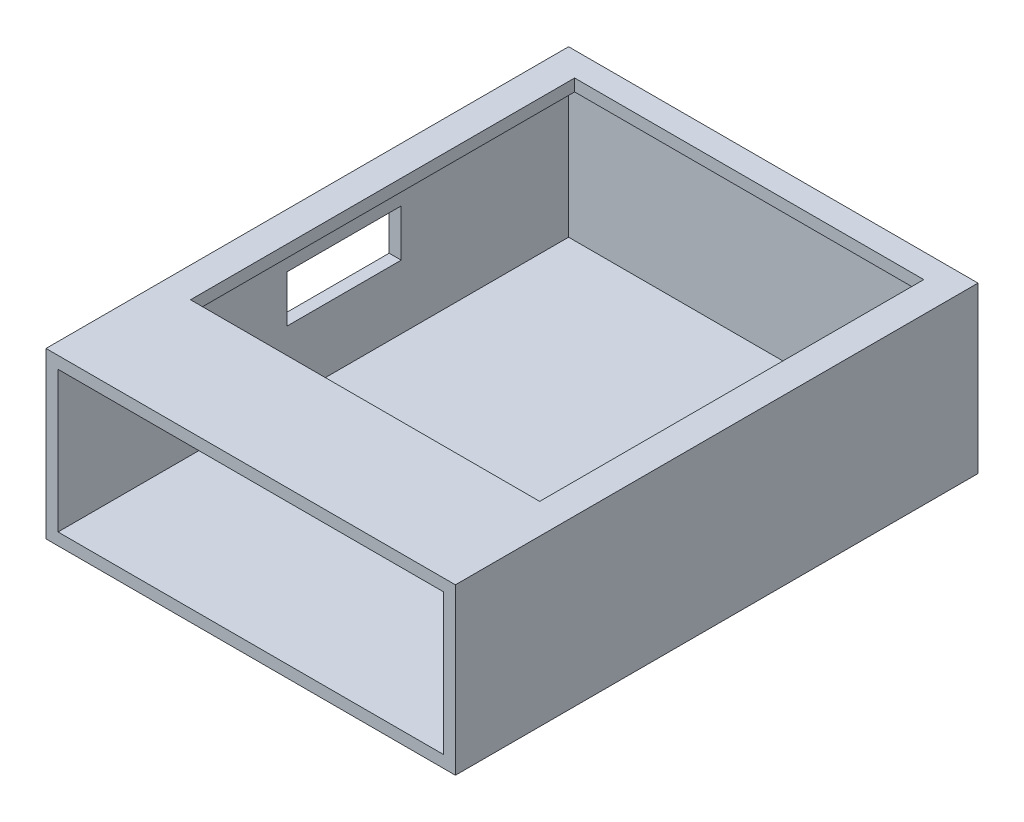
from build123d import *

# Parameters (mm, degrees)
SKETCH_1_W            = 32
SKETCH_1_H            = 42.4
EXTRUDE_1_DEPTH       = 11.7
SHELL_1_T             = 1
CUT_EXTRUDE_664_REACH = 58.36
SKETCH_2_W            = 9.5
SKETCH_2_H            = 3.9
SKETCH_4_W            = 34
SKETCH_4_H            = 43.4
SKETCH_4_W_2          = 29
SKETCH_4_H_2          = 31.9
EXTRUDE_2_DEPTH       = 1


with BuildPart() as part:
    # 草图1 → 凸台-拉伸1 (new body)
    with BuildSketch(Plane(origin=(0, 0, 0), x_dir=(1, 0, 0), z_dir=(0, 1, 0))):
        with Locations((16, 21.2)):
            Rectangle(SKETCH_1_W, SKETCH_1_H)
    extrude(amount=EXTRUDE_1_DEPTH)

    # 抽壳1
    shell_1_openings = [part.faces().sort_by_distance(p)[0] for p in [
        (16, 5.85, 0),
        (16, 11.7, -21.2),
    ]]
    offset(amount=SHELL_1_T, openings=shell_1_openings, kind=Kind.INTERSECTION)

    # 草图2 → Cut-Extrude 664 (cut, up to next)
    with BuildSketch(Plane.ZY.offset(1), mode=Mode.PRIVATE) as cut_extrude_664_sk1:
        with Locations((-23.75, 7.25)):
            Rectangle(SKETCH_2_W, SKETCH_2_H)
    cut_extrude_664_tool1 = extrude(cut_extrude_664_sk1.sketch, amount=-CUT_EXTRUDE_664_REACH, mode=Mode.PRIVATE) & part.part
    # 草图2 → Cut-Extrude 664 (cut, up to next)
    with BuildSketch(Plane.ZY.offset(1), mode=Mode.PRIVATE) as cut_extrude_664_sk2:
        Polygon((-11.25, 8.3), (-9.65, 8.3), (-9.65, 6.1), (-12.85, 6.1), (-12.85, 8.3), align=None)
    cut_extrude_664_tool2 = extrude(cut_extrude_664_sk2.sketch, amount=-CUT_EXTRUDE_664_REACH, mode=Mode.PRIVATE) & part.part
    add(cut_extrude_664_tool1.solids().sort_by_distance((-1, 7.25, -23.75))[0], mode=Mode.SUBTRACT)
    add(cut_extrude_664_tool2.solids().sort_by_distance((-1, 7.2, -11.25))[0], mode=Mode.SUBTRACT)

    # 草图4 → 凸台-拉伸2 (add)
    with BuildSketch(Plane(origin=(0, 11.7, 0), x_dir=(1, 0, 0), z_dir=(0, 1, 0))):
        with Locations((16, 21.7)):
            Rectangle(SKETCH_4_W, SKETCH_4_H)
        with Locations((16, 25.45)):
            Rectangle(SKETCH_4_W_2, SKETCH_4_H_2, mode=Mode.SUBTRACT)
    extrude(amount=EXTRUDE_2_DEPTH)


solid = part.part
